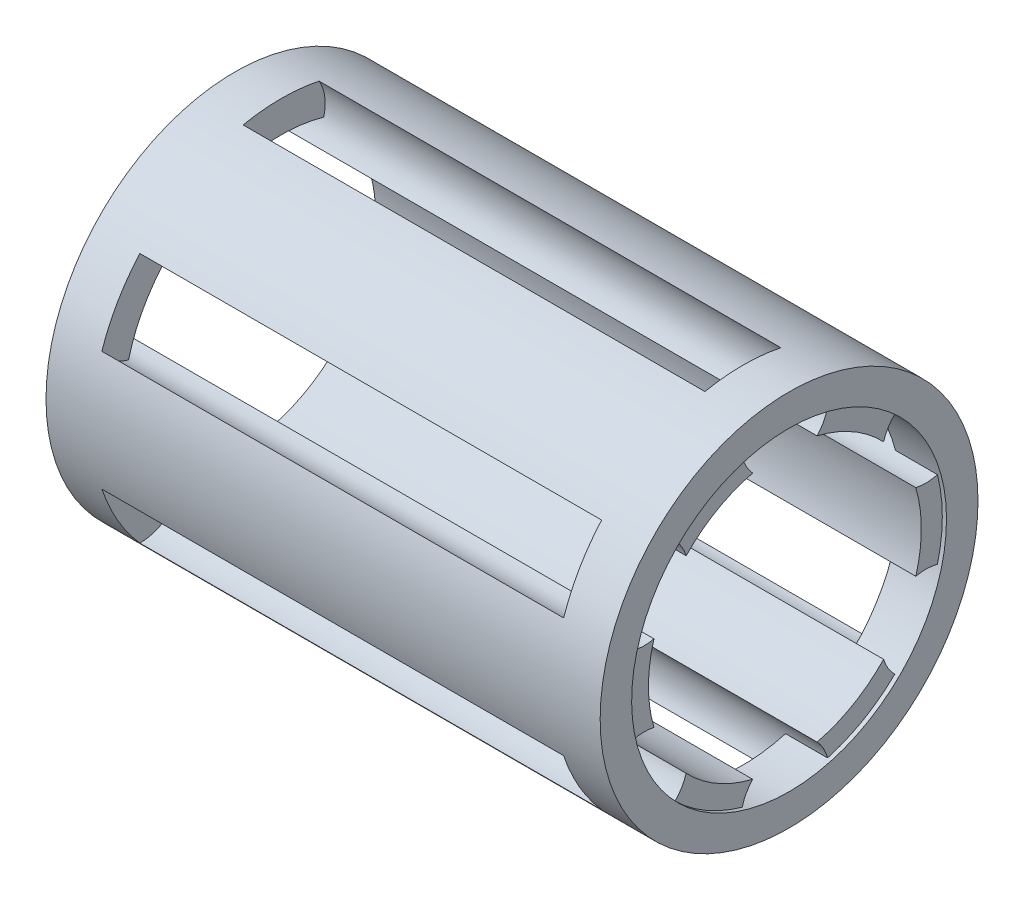
from build123d import *

# Parameters (mm, degrees)
BOSS_EXTRUDE1_DEPTH      = 26
BOSS_EXTRUDE1_2_DEPTH    = 26
BOSS_EXTRUDE1_3_DEPTH    = 26
BOSS_EXTRUDE1_4_DEPTH    = 26
BOSS_EXTRUDE1_5_DEPTH    = 26
BOSS_EXTRUDE1_6_DEPTH    = 26
BOSS_EXTRUDE2_DEPTH      = 0.2
BOSS_EXTRUDE2_DEPTH_BACK = 2
SKETCH2_R                = 9
SKETCH2_R_2              = 7.5
BOSS_EXTRUDE3_DEPTH      = 0.2
BOSS_EXTRUDE3_DEPTH_BACK = 2
SKETCH3_R                = 9
SKETCH3_R_2              = 7.5


with BuildPart() as part:
    # Sketch1 → Boss-Extrude1 (new body)
    with BuildSketch(Plane(origin=(0, 0, 0), x_dir=(0, 0, -1), z_dir=(1, 0, 0))):
        with BuildLine():
            ThreePointArc((-1.809150339, 8.816290323), (-4.5, 7.794228634), (-6.730556217, 5.974915314))
            ThreePointArc((-6.730556217, 5.974915314), (-5.469327251, 5.568079356), (-4.702852692, 4.487000842))
            ThreePointArc((-4.702852692, 4.487000842), (-3.25, 5.629165125), (-1.53443037, 6.316290323))
            ThreePointArc((-1.53443037, 6.316290323), (-2.087434547, 7.520616019), (-1.809150339, 8.816290323))
        make_face()
    extrude(amount=BOSS_EXTRUDE1_DEPTH)



with BuildPart() as body_2:
    # Sketch1 → Boss-Extrude1 2 (new body)
    with BuildSketch(Plane(origin=(0, 0, 0), x_dir=(0, 0, -1), z_dir=(1, 0, 0))):
        with BuildLine():
            ThreePointArc((6.237283062, 1.82928948), (7.556761798, 1.952536663), (8.539706556, 2.841375009))
            ThreePointArc((8.539706556, 2.841375009), (9, 0), (8.539706556, -2.841375009))
            ThreePointArc((8.539706556, -2.841375009), (7.556761798, -1.952536663), (6.237283062, -1.82928948))
            ThreePointArc((6.237283062, -1.82928948), (6.5, 0), (6.237283062, 1.82928948))
        make_face()
    extrude(amount=BOSS_EXTRUDE1_2_DEPTH)


with BuildPart() as body_3:
    # Sketch1 → Boss-Extrude1 3 (new body)
    with BuildSketch(Plane(origin=(0, 0, 0), x_dir=(0, 0, -1), z_dir=(1, 0, 0))):
        with BuildLine():
            ThreePointArc((-1.53443037, -6.316290323), (-2.087434547, -7.520616019), (-1.809150339, -8.816290323))
            ThreePointArc((-1.809150339, -8.816290323), (-4.5, -7.794228634), (-6.730556217, -5.974915314))
            ThreePointArc((-6.730556217, -5.974915314), (-5.469327251, -5.568079356), (-4.702852692, -4.487000842))
            ThreePointArc((-4.702852692, -4.487000842), (-3.25, -5.629165125), (-1.53443037, -6.316290323))
        make_face()
    extrude(amount=BOSS_EXTRUDE1_3_DEPTH)


with BuildPart() as body_4:
    # Sketch1 → Boss-Extrude1 4 (new body)
    with BuildSketch(Plane(origin=(0, 0, 0), x_dir=(0, 0, -1), z_dir=(1, 0, 0))):
        with BuildLine():
            ThreePointArc((1.53443037, 6.316290323), (2.087434547, 7.520616019), (1.809150339, 8.816290323))
            ThreePointArc((1.809150339, 8.816290323), (4.5, 7.794228634), (6.730556217, 5.974915314))
            ThreePointArc((6.730556217, 5.974915314), (5.469327251, 5.568079356), (4.702852692, 4.487000842))
            ThreePointArc((4.702852692, 4.487000842), (3.25, 5.629165125), (1.53443037, 6.316290323))
        make_face()
    extrude(amount=BOSS_EXTRUDE1_4_DEPTH)


with BuildPart() as body_5:
    # Sketch1 → Boss-Extrude1 5 (new body)
    with BuildSketch(Plane(origin=(0, 0, 0), x_dir=(0, 0, -1), z_dir=(1, 0, 0))):
        with BuildLine():
            ThreePointArc((-6.237283062, 1.82928948), (-6.5, 0), (-6.237283062, -1.82928948))
            ThreePointArc((-6.237283062, -1.82928948), (-7.556761798, -1.952536663), (-8.539706556, -2.841375009))
            ThreePointArc((-8.539706556, -2.841375009), (-9, 0), (-8.539706556, 2.841375009))
            ThreePointArc((-8.539706556, 2.841375009), (-7.556761798, 1.952536663), (-6.237283062, 1.82928948))
        make_face()
    extrude(amount=BOSS_EXTRUDE1_5_DEPTH)


with BuildPart() as body_6:
    # Sketch1 → Boss-Extrude1 6 (new body)
    with BuildSketch(Plane(origin=(0, 0, 0), x_dir=(0, 0, -1), z_dir=(1, 0, 0))):
        with BuildLine():
            ThreePointArc((4.702852692, -4.487000842), (5.469327251, -5.568079356), (6.730556217, -5.974915314))
            ThreePointArc((6.730556217, -5.974915314), (4.5, -7.794228634), (1.809150339, -8.816290323))
            ThreePointArc((1.809150339, -8.816290323), (2.087434547, -7.520616019), (1.53443037, -6.316290323))
            ThreePointArc((1.53443037, -6.316290323), (3.25, -5.629165125), (4.702852692, -4.487000842))
        make_face()
    extrude(amount=BOSS_EXTRUDE1_6_DEPTH)


with BuildPart() as part_1:
    add(part.part)

    add(body_2.part)  # Boss-Extrude2 merges body 2

    add(body_3.part)  # Boss-Extrude2 merges body 3

    add(body_4.part)  # Boss-Extrude2 merges body 4

    add(body_5.part)  # Boss-Extrude2 merges body 5

    add(body_6.part)  # Boss-Extrude2 merges body 6
    # Sketch2 → Boss-Extrude2 (add, two sides: drawn at the far end of the back side and taken through both)
    with BuildSketch(Plane(origin=(26, 0, 0), x_dir=(0, 0, -1), z_dir=(1, 0, 0)).offset(-BOSS_EXTRUDE2_DEPTH_BACK)):
        with Locations(Location((0, 0, 0), (0, 0, 161.596419423))):
            Circle(SKETCH2_R)
        with Locations(Location((0, 0, 0), (0, 0, 165.71895949))):
            Circle(SKETCH2_R_2, mode=Mode.SUBTRACT)
    extrude(amount=BOSS_EXTRUDE2_DEPTH + BOSS_EXTRUDE2_DEPTH_BACK)

    # Sketch3 → Boss-Extrude3 (add, two sides: drawn at the far end of the back side and taken through both)
    with BuildSketch(Plane.ZY.offset(-BOSS_EXTRUDE3_DEPTH_BACK)):
        Circle(SKETCH3_R)
        with Locations(Location((0, 0, 0), (0, 0, 14.28104051))):
            Circle(SKETCH3_R_2, mode=Mode.SUBTRACT)
    extrude(amount=BOSS_EXTRUDE3_DEPTH + BOSS_EXTRUDE3_DEPTH_BACK)


solid = part_1.part
